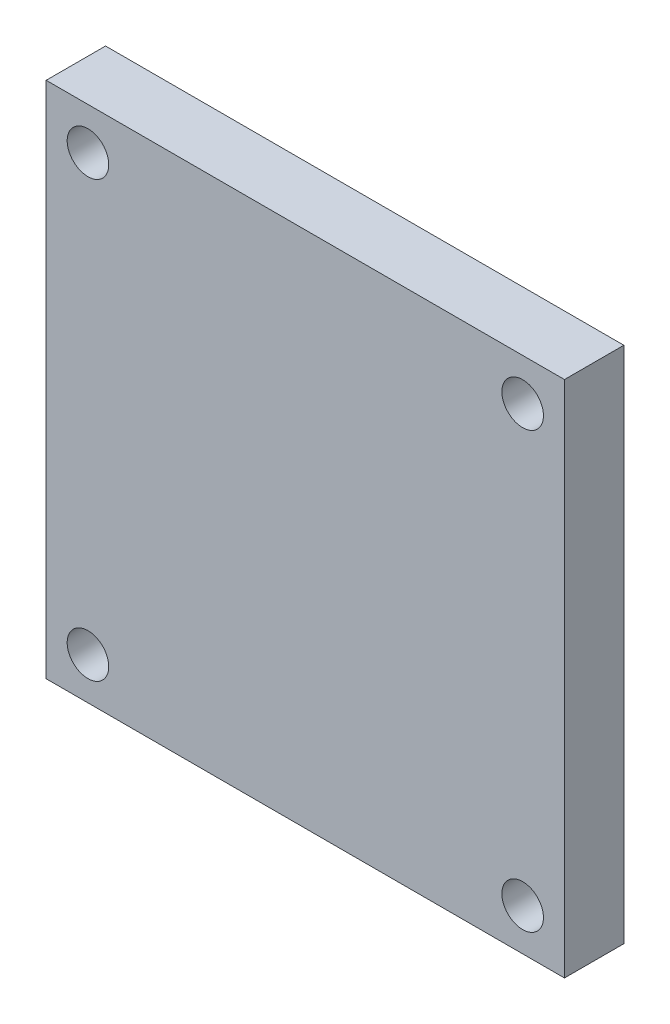
from build123d import *

# Parameters (mm, degrees)
SKETCH_1_W      = 43.64
SKETCH_1_H      = 43.64
SKETCH_1_R      = 1.75
EXTRUDE_1_DEPTH = 5


with BuildPart() as part:
    # 草图1 → 凸台-拉伸1 (new body)
    with BuildSketch(Plane.XY):
        Rectangle(SKETCH_1_W, SKETCH_1_H)
        with Locations((-18.3, -18.3)):
            Circle(SKETCH_1_R, mode=Mode.SUBTRACT)
        with Locations((-18.3, 18.3)):
            Circle(SKETCH_1_R, mode=Mode.SUBTRACT)
        with Locations((18.3, 18.3)):
            Circle(SKETCH_1_R, mode=Mode.SUBTRACT)
        with Locations((18.3, -18.3)):
            Circle(SKETCH_1_R, mode=Mode.SUBTRACT)
    extrude(amount=EXTRUDE_1_DEPTH)


solid = part.part
